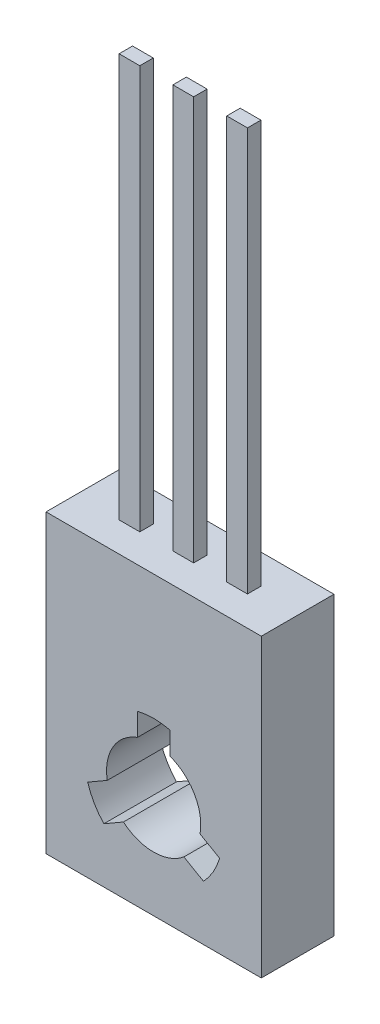
from build123d import *

# Parameters (mm, degrees)
SKETCH1_W           = 8
SKETCH1_H           = 11
SKETCH1_R           = 2.555
BOSS_EXTRUDE1_DEPTH = 1.35
SKETCH2_W           = 0.77
SKETCH2_H           = 0.5
BOSS_EXTRUDE2_DEPTH = 15
BOSS_EXTRUDE3_DEPTH = 2.7


with BuildPart() as part:
    # Sketch1 → Boss-Extrude1 (new, symmetric)
    with BuildSketch(Plane.XY):
        Rectangle(SKETCH1_W, SKETCH1_H)
        with Locations(Location((0, -1.7, 0), (0, 0, 180))):
            Circle(SKETCH1_R, mode=Mode.SUBTRACT)
    extrude(amount=BOSS_EXTRUDE1_DEPTH, both=True)

    # Sketch2 → Boss-Extrude2 (add)
    with BuildSketch(Plane(origin=(0, 5.5, 0), x_dir=(1, 0, 0), z_dir=(0, 1, 0))):
        Rectangle(SKETCH2_W, SKETCH2_H)
        with Locations((-2, 0)):
            Rectangle(SKETCH2_W, SKETCH2_H)
        with Locations((2, 0)):
            Rectangle(SKETCH2_W, SKETCH2_H)
    extrude(amount=BOSS_EXTRUDE2_DEPTH)

    # Sketch4 → Boss-Extrude3 (add)
    with BuildSketch(Plane.XY.offset(1.35)):
        with BuildLine():
            Line((-0.6, 0.823242633), (-0.6, -0.056071778))
            ThreePointArc((-0.6, -0.056071778), (-1.515544457, -0.825), (-1.723683602, -2.002348869))
            Line((-1.723683602, -2.002348869), (-2.48519222, -2.442006074))
            ThreePointArc((-2.48519222, -2.442006074), (-2.246122223, -0.40320073), (-0.6, 0.823242633))
        make_face()
        with BuildLine():
            Line((0.6, 0.823242633), (0.6, -0.056071778))
            ThreePointArc((0.6, -0.056071778), (1.515544457, -0.825), (1.723683602, -2.002348869))
            Line((1.723683602, -2.002348869), (2.48519222, -2.442006074))
            ThreePointArc((2.48519222, -2.442006074), (2.246122223, -0.40320073), (0.6, 0.823242633))
        make_face()
        with BuildLine():
            Line((1.88519222, -3.481236559), (1.123683602, -3.041579353))
            ThreePointArc((1.123683602, -3.041579353), (0, -3.45), (-1.123683602, -3.041579353))
            Line((-1.123683602, -3.041579353), (-1.88519222, -3.481236559))
            ThreePointArc((-1.88519222, -3.481236559), (0, -4.29359854), (1.88519222, -3.481236559))
        make_face()
    extrude(amount=-BOSS_EXTRUDE3_DEPTH)


solid = part.part
